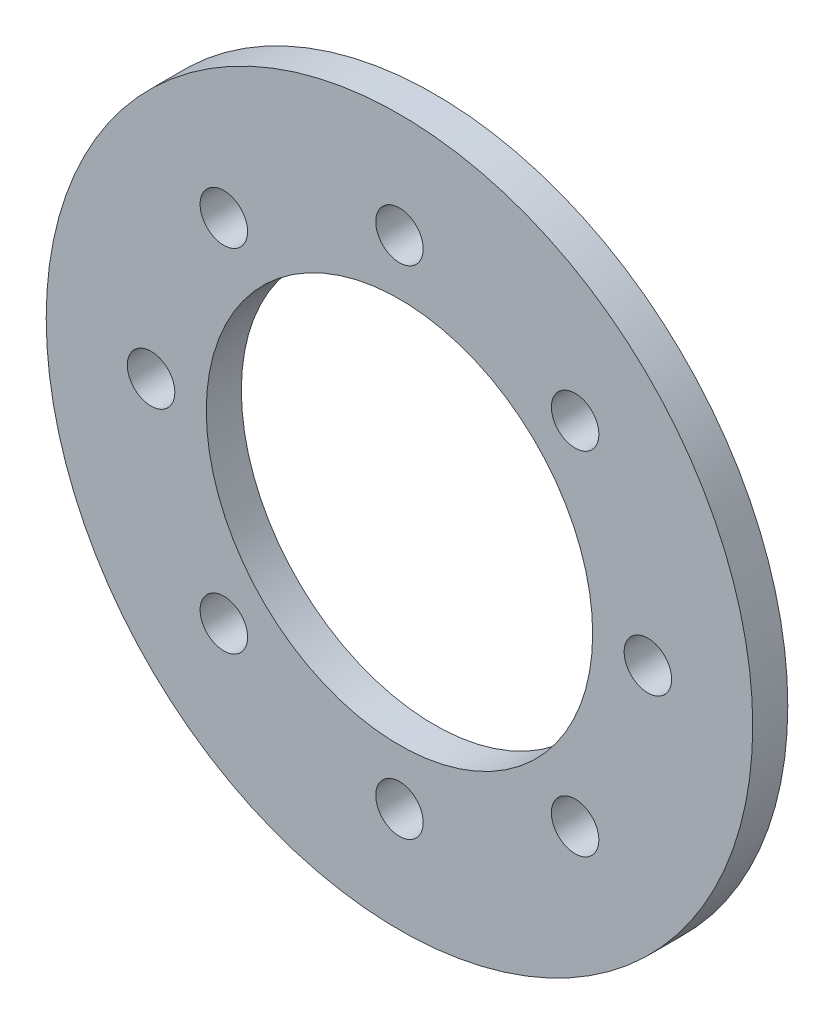
from build123d import *

# Parameters (mm, degrees)
SKETCH1_R           = 32
SKETCH1_R_2         = 17.5
SKETCH1_R_3         = 2.15
BOSS_EXTRUDE1_DEPTH = 1.5875


with BuildPart() as part:
    # Sketch1 → Boss-Extrude1 (new, symmetric)
    with BuildSketch(Plane(origin=(0, 0, 0), x_dir=(0, 1, 0), z_dir=(0, 0, 1))):
        with Locations(Location((0, 0, 0), (0, 0, 270))):
            Circle(SKETCH1_R)
        with Locations(Location((0, 0, 0), (0, 0, 270))):
            Circle(SKETCH1_R_2, mode=Mode.SUBTRACT)
        with Locations(Location((0, 22.5, 0), (0, 0, 270))):
            Circle(SKETCH1_R_3, mode=Mode.SUBTRACT)
        with Locations(Location((15.909902577, 15.909902577, 0), (0, 0, 270))):
            Circle(SKETCH1_R_3, mode=Mode.SUBTRACT)
        with Locations(Location((22.5, 0, 0), (0, 0, 270))):
            Circle(SKETCH1_R_3, mode=Mode.SUBTRACT)
        with Locations(Location((15.909902577, -15.909902577, 0), (0, 0, 270))):
            Circle(SKETCH1_R_3, mode=Mode.SUBTRACT)
        with Locations(Location((0, -22.5, 0), (0, 0, 270))):
            Circle(SKETCH1_R_3, mode=Mode.SUBTRACT)
        with Locations(Location((-15.909902577, -15.909902577, 0), (0, 0, 270))):
            Circle(SKETCH1_R_3, mode=Mode.SUBTRACT)
        with Locations(Location((-22.5, 0, 0), (0, 0, 270))):
            Circle(SKETCH1_R_3, mode=Mode.SUBTRACT)
        with Locations(Location((-15.909902577, 15.909902577, 0), (0, 0, 270))):
            Circle(SKETCH1_R_3, mode=Mode.SUBTRACT)
    extrude(amount=BOSS_EXTRUDE1_DEPTH, both=True)


solid = part.part
